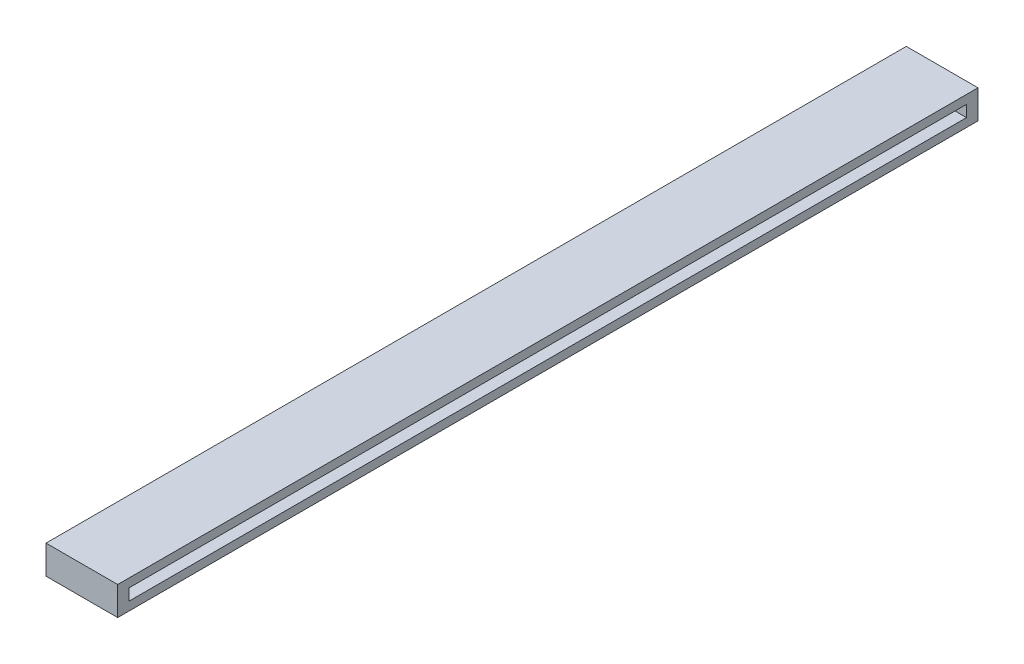
from build123d import *

# Parameters (mm, degrees)
SKETCH_1_W      = 15
SKETCH_1_H      = 300
EXTRUDE_1_DEPTH = 4
SKETCH_2_W      = 4
SKETCH_2_H      = 4
EXTRUDE_2_DEPTH = 10
SKETCH_3_W      = 25
SKETCH_3_H      = 300
EXTRUDE_3_DEPTH = 3
SKETCH_4_W      = 25
SKETCH_4_H      = 300
EXTRUDE_4_DEPTH = 3


with BuildPart() as part:
    # 草图1 → 凸台-拉伸1 (new body)
    with BuildSketch(Plane(origin=(0, 0, 0), x_dir=(1, 0, 0), z_dir=(0, 1, 0))):
        with Locations((-54.836215811, -65.70889057)):
            Rectangle(SKETCH_1_W, SKETCH_1_H)
    extrude(amount=EXTRUDE_1_DEPTH)

    # 草图2 → 凸台-拉伸2 (add)
    with BuildSketch(Plane(origin=(-47.336215811, 0, 0), x_dir=(0, 0, -1), z_dir=(1, 0, 0))):
        with Locations((-213.70889057, 2)):
            Rectangle(SKETCH_2_W, SKETCH_2_H)
        with Locations((82.29110943, 2)):
            Rectangle(SKETCH_2_W, SKETCH_2_H)
    extrude(amount=EXTRUDE_2_DEPTH)

    # 草图3 → 凸台-拉伸3 (add)
    with BuildSketch(Plane(origin=(0, 4, 0), x_dir=(1, 0, 0), z_dir=(0, 1, 0))):
        with Locations((-49.836215811, -65.70889057)):
            Rectangle(SKETCH_3_W, SKETCH_3_H)
    extrude(amount=EXTRUDE_3_DEPTH)

    # 草图4 → 凸台-拉伸4 (add)
    with BuildSketch(Plane.XZ):
        with Locations((-49.836215811, 65.70889057)):
            Rectangle(SKETCH_4_W, SKETCH_4_H)
    extrude(amount=EXTRUDE_4_DEPTH)


solid = part.part
